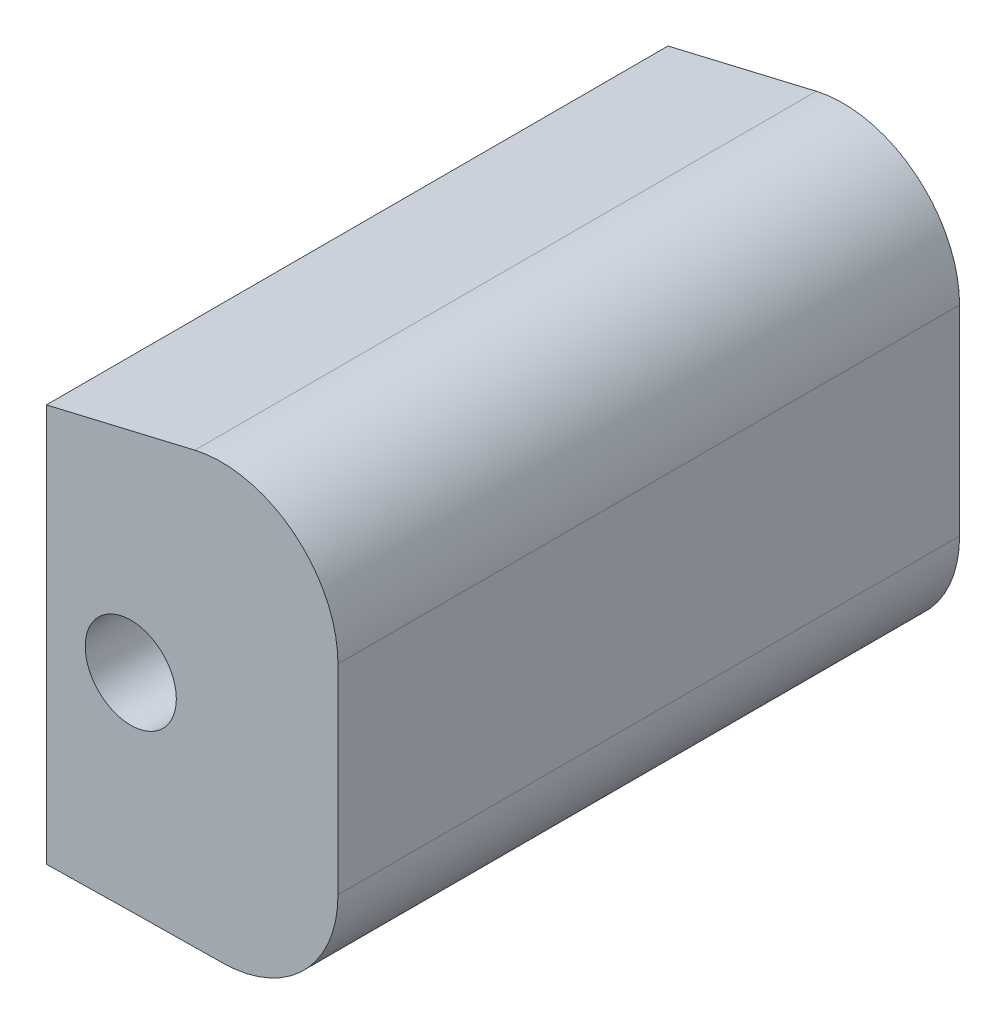
from build123d import *

# Parameters (mm, degrees)
SKETCH1_R           = 2.127
SKETCH1_R_2         = 1.984375
BOSS_EXTRUDE1_DEPTH = 27.0764
SKETCH2_W           = 88.723085019
SKETCH2_H           = 32.948386637
CUT_EXTRUDE1_DEPTH  = 27.0764


with BuildPart() as part:
    # Sketch1 → Boss-Extrude1 (new body)
    with BuildSketch(Plane.XY):
        with BuildLine():
            Line((42.918297493, -0.447743106), (42.918297493, 8.263094686))
            ThreePointArc((42.918297493, 8.263094686), (40.994864427, 12.243356636), (36.681098599, 13.209536914))
            add(Edge.make_bspline(
                [(36.681098599, 13.209536914), (19.829765645, 9.267240013), (-2.073589943, 3.844068304), (-31.096466219, -5.545914493), (-39.316765165, -8.806631661), (-49.515556323, -12.495660485), (-45.77248955, -12.10685039)],
                knots=[0.118068853, 0.118068853, 0.118068853, 0.118068853, 0.630725311, 0.824213609, 0.940085477, 1, 1, 1, 1], degree=3))
            add(Edge.make_bspline(
                [(-45.77248955, -12.10685039), (-41.337443699, -10.999265489), (-33.831609628, -10.530043097), (-20.483498257, -8.707547198), (-8.873433654, -8.01917435), (11.524588595, -6.028171323), (26.067321973, -5.659784939), (37.895141959, -5.527425055)],
                knots=[0, 0, 0, 0, 0.144322392, 0.237947652, 0.42712275, 0.512831912, 0.887817721, 0.887817721, 0.887817721, 0.887817721], degree=3))
            ThreePointArc((37.895141959, -5.527425055), (41.450441586, -4.019691462), (42.918297493, -0.447743106))
        make_face()
        with Locations((-19.10248955, -6.01085039)):
            Circle(SKETCH1_R, mode=Mode.SUBTRACT)
        with Locations((12.64751045, 4.40314961)):
            Circle(SKETCH1_R, mode=Mode.SUBTRACT)
        with Locations((33.89346968, 3.421717851)):
            Circle(SKETCH1_R_2, mode=Mode.SUBTRACT)
    extrude(amount=BOSS_EXTRUDE1_DEPTH)

    # Sketch2 → Cut-Extrude1 (cut)
    with BuildSketch(Plane.XY.offset(27.0764)):
        with Locations((-14.143245016, -2.355433399)):
            Rectangle(SKETCH2_W, SKETCH2_H)
    extrude(amount=-CUT_EXTRUDE1_DEPTH, mode=Mode.SUBTRACT)


solid = part.part
